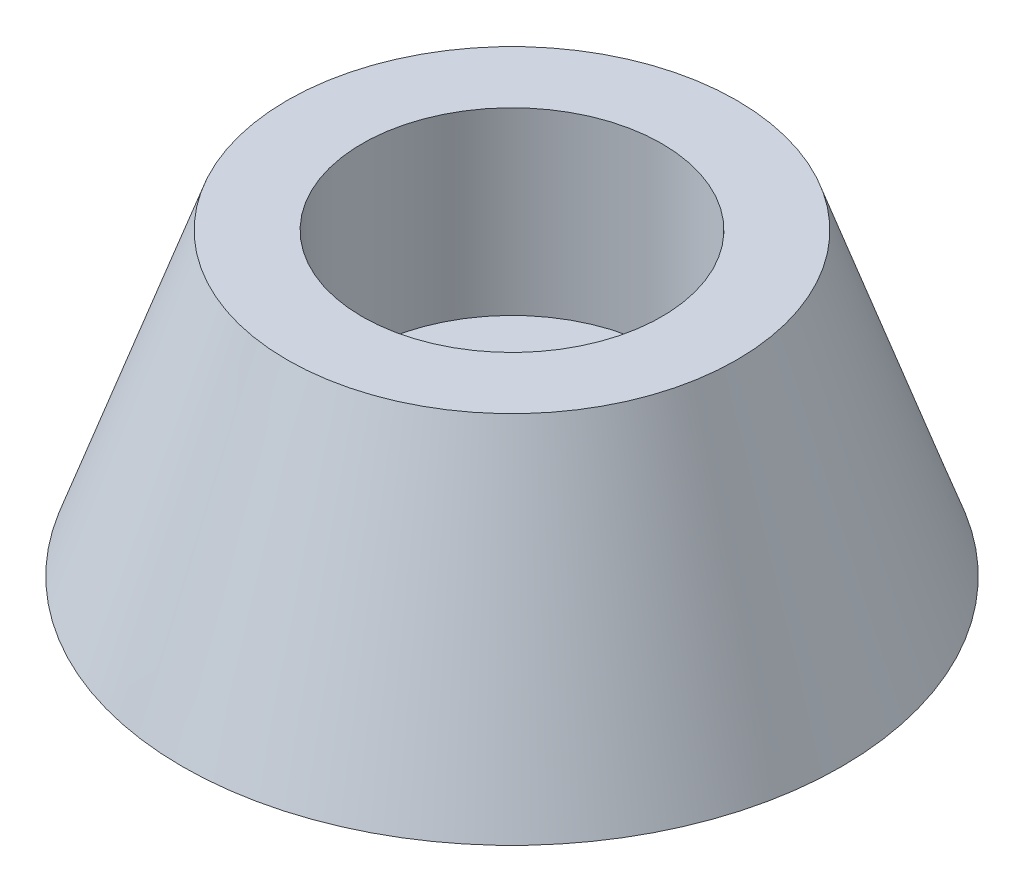
from build123d import *

# Parameters (mm, degrees)
SKETCH_3_R          = 2.25
CUT_EXTRUDE_1_DEPTH = 10
SKETCH_4_R          = 5
CUT_EXTRUDE_2_DEPTH = 6


with BuildPart() as part:
    # Эскиз2 → Повернуть1 (revolve)
    with BuildSketch(Plane.XY, mode=Mode.PRIVATE) as revolve_1_sk:
        Polygon((0, 4.367021277), (-7.5, 4.367021277), (-11, -5.632978723), (0, -5.632978723), align=None)
    revolve(revolve_1_sk.sketch.rotate(Axis((0, -5.632978723, 0), (0, 1, 0)), 270), axis=Axis((0, -5.632978723, 0), (0, 1, 0)))

    # Эскиз3 → Вырез-Вытянуть1 (cut)
    with BuildSketch(Plane(origin=(0, 4.367021277, 0), x_dir=(1, 0, 0), z_dir=(0, 1, 0))):
        with Locations(Location((0, 0, 0), (0, 0, 270))):
            Circle(SKETCH_3_R)
    extrude(amount=-CUT_EXTRUDE_1_DEPTH, mode=Mode.SUBTRACT)

    # Эскиз4 → Вырез-Вытянуть2 (cut)
    with BuildSketch(Plane(origin=(0, 4.367021277, 0), x_dir=(1, 0, 0), z_dir=(0, 1, 0))):
        with Locations(Location((0, 0, 0), (0, 0, 270))):
            Circle(SKETCH_4_R)
    extrude(amount=-CUT_EXTRUDE_2_DEPTH, mode=Mode.SUBTRACT)


solid = part.part
